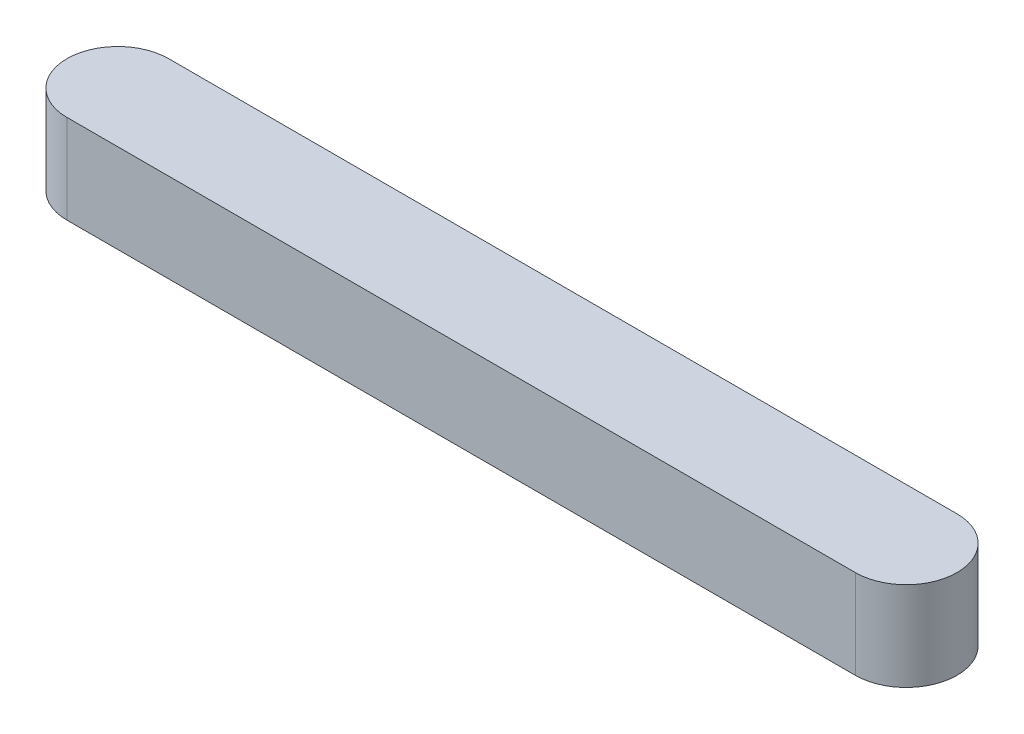
from build123d import *

# Parameters (mm, degrees)
EXTRUDE_1_DEPTH = 7


with BuildPart() as part:
    # Эскиз1 → Бобышка-Вытянуть1 (new body)
    with BuildSketch(Plane(origin=(0, 0, 0), x_dir=(1, 0, 0), z_dir=(0, 1, 0))):
        with BuildLine():
            Line((0, 4), (62, 4))
            ThreePointArc((62, 4), (66, 0), (62, -4))
            Line((62, -4), (0, -4))
            ThreePointArc((0, -4), (-4, 0), (0, 4))
        make_face()
    extrude(amount=EXTRUDE_1_DEPTH)


solid = part.part
